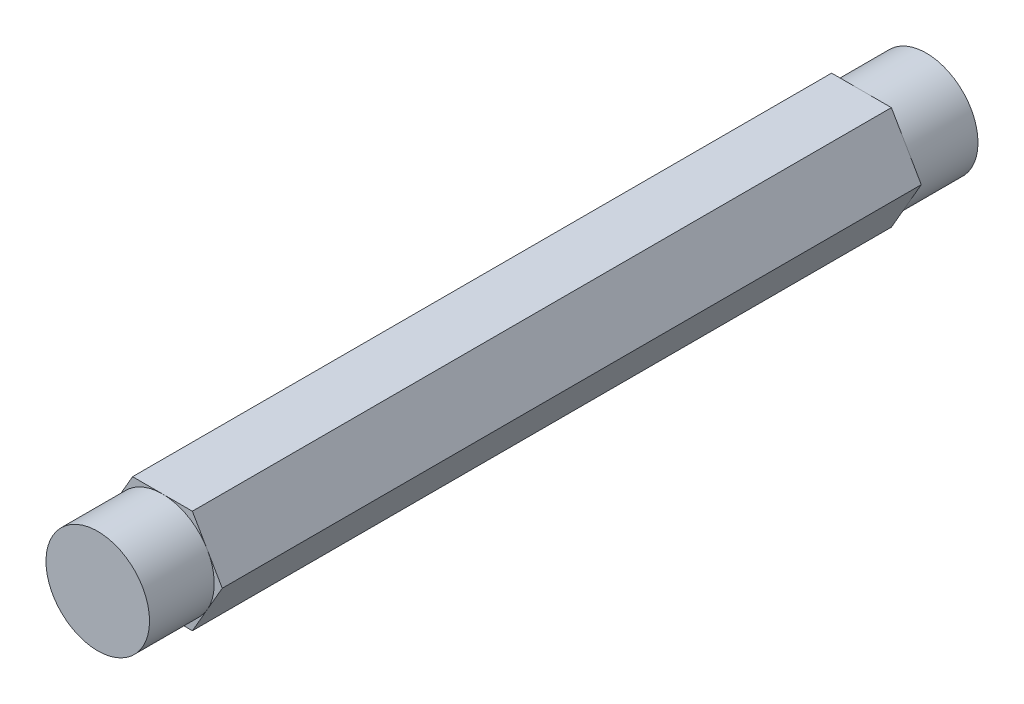
from build123d import *

# Parameters (mm, degrees)
BOSS_EXTRUDE1_DEPTH     = 50.8
SKETCH2_R               = 8.89
SKETCH2_R_2             = 6.35
CUT_EXTRUDE_THIN1_DEPTH = 7.9375


with BuildPart() as part:
    # Sketch1 → Boss-Extrude1 (new, symmetric)
    with BuildSketch(Plane.XY):
        Polygon((7.332348419, 0), (3.666174209, 6.35), (-3.666174209, 6.35), (-7.332348419, 0), (-3.666174209, -6.35), (3.666174209, -6.35), align=None)
    extrude(amount=BOSS_EXTRUDE1_DEPTH, both=True)

    # Sketch2 → Cut-Extrude-Thin1 (cut)
    with BuildSketch(Plane.XY.offset(42.8625)):
        Circle(SKETCH2_R)
        Circle(SKETCH2_R_2, mode=Mode.SUBTRACT)
    cut_extrude_thin1 = extrude(amount=CUT_EXTRUDE_THIN1_DEPTH, mode=Mode.SUBTRACT)

    # Mirror1: Cut-Extrude-Thin1 across plane
    add(cut_extrude_thin1.mirror(Plane.XY), mode=Mode.SUBTRACT)


solid = part.part
